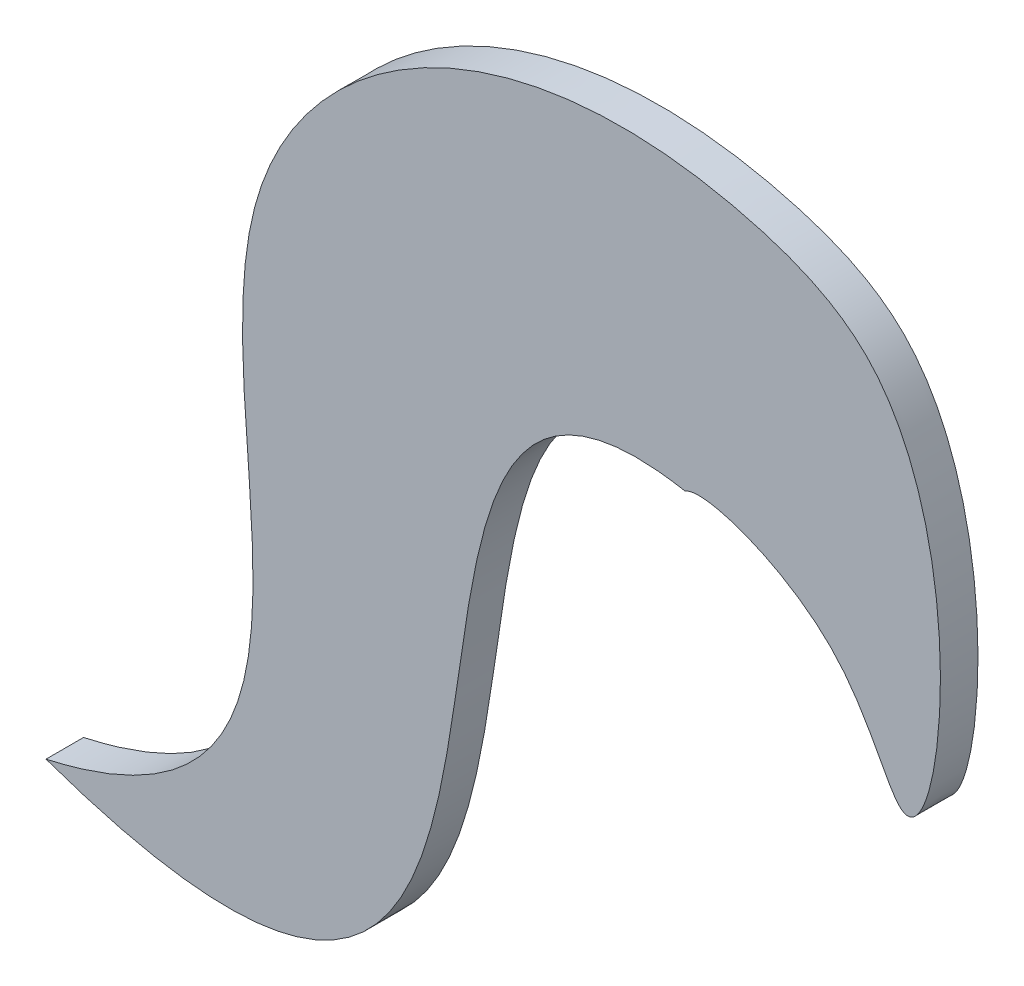
from build123d import *

# Parameters (mm, degrees)
SALIENTE_EXTRUIR1_DEPTH = 3


with BuildPart() as part:
    # Croquis1 → Saliente-Extruir1 (new body)
    with BuildSketch(Plane.XY):
        with BuildLine():
            add(Edge.make_bspline(
                [(0, 0), (50.696437465, -17.865936521), (18.222363292, 50.158548268), (51.06889469, 44.06122449)],
                knots=[0, 0, 0, 0, 1, 1, 1, 1], degree=3))
            add(Edge.make_bspline(
                [(0, 0), (26.549708119, 5.874291873), (0.152368527, 48.836079058), (40.129582463, 72.144318359), (74.849161224, 58.521784811), (70.745146913, 20.033974167), (64.151770383, 41.292136834), (52.449610492, 45.07069114), (51.06889469, 44.06122449)],
                knots=[0, 0, 0, 0, 0.352431525, 0.634744097, 0.684719821, 0.852188771, 0.914972812, 1, 1, 1, 1], degree=3))
        make_face()
    extrude(amount=SALIENTE_EXTRUIR1_DEPTH)


solid = part.part
